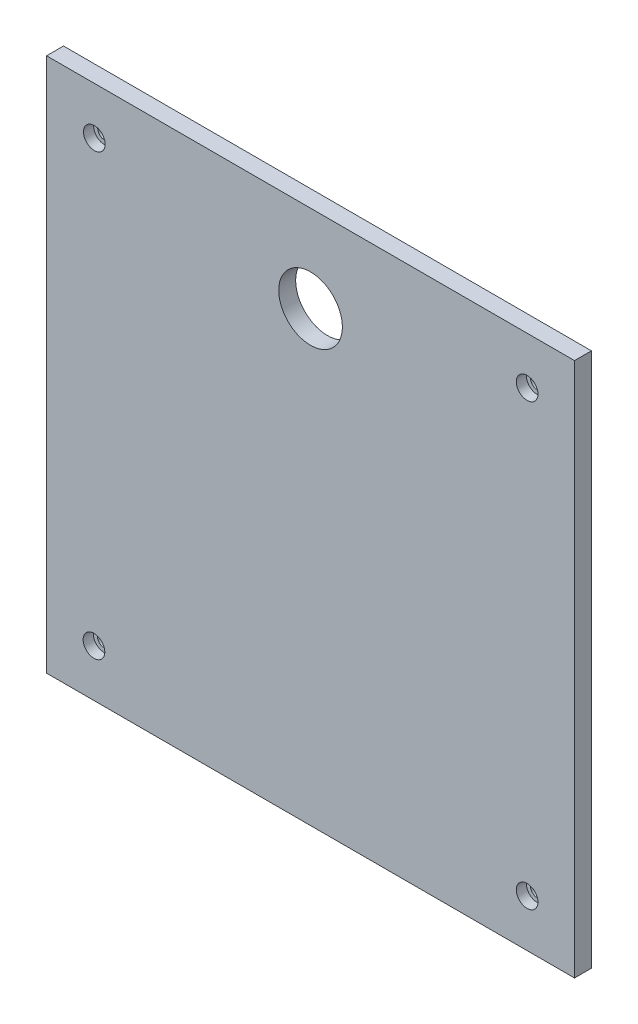
from build123d import *

# Parameters (mm, degrees)
SKETCH_213_W        = 78
SKETCH_213_H        = 79
EXTRUDE_3_DEPTH     = 2.5
CUT_EXTRUDE_4_REACH = 59.522
SKETCH_10_R         = 1.00000254
SKETCH_10_R_2       = 4.7
CUT_EXTRUDE_START   = 1
SKETCH_12_R         = 1.6
CUT_EXTRUDE_6_DEPTH = 2.5
SKETCH_11_W         = 57.00006223
SKETCH_11_H         = 48.946928069
CUT_EXTRUDE_7_DEPTH = 1


with BuildPart() as part:
    # Sketch 213 → 凸台-拉伸3 (new body)
    with BuildSketch(Plane.XY):
        with Locations((1.76392246, -1.007858704)):
            Rectangle(SKETCH_213_W, SKETCH_213_H)
    extrude(amount=EXTRUDE_3_DEPTH)

    # Sketch 10 → 切除-拉伸4 (cut, up to next)
    with BuildSketch(Plane.XY, mode=Mode.PRIVATE) as cut_extrude_4_sk1:
        with Locations((-30.179759278, 31.492141296)):
            Circle(SKETCH_10_R)
    cut_extrude_4_tool1 = extrude(cut_extrude_4_sk1.sketch, amount=CUT_EXTRUDE_4_REACH, mode=Mode.PRIVATE) & part.part
    # Sketch 10 → 切除-拉伸4 (cut, up to next)
    with BuildSketch(Plane.XY, mode=Mode.PRIVATE) as cut_extrude_4_sk2:
        with Locations((33.76398723, 31.492283536)):
            Circle(SKETCH_10_R)
    cut_extrude_4_tool2 = extrude(cut_extrude_4_sk2.sketch, amount=CUT_EXTRUDE_4_REACH, mode=Mode.PRIVATE) & part.part
    # Sketch 10 → 切除-拉伸4 (cut, up to next)
    with BuildSketch(Plane.XY, mode=Mode.PRIVATE) as cut_extrude_4_sk3:
        with Locations((33.76398723, -33.507848544)):
            Circle(SKETCH_10_R)
    cut_extrude_4_tool3 = extrude(cut_extrude_4_sk3.sketch, amount=CUT_EXTRUDE_4_REACH, mode=Mode.PRIVATE) & part.part
    # Sketch 10 → 切除-拉伸4 (cut, up to next)
    with BuildSketch(Plane.XY, mode=Mode.PRIVATE) as cut_extrude_4_sk4:
        with Locations((-30.23614231, -33.507848544)):
            Circle(SKETCH_10_R)
    cut_extrude_4_tool4 = extrude(cut_extrude_4_sk4.sketch, amount=CUT_EXTRUDE_4_REACH, mode=Mode.PRIVATE) & part.part
    # Sketch 10 → 切除-拉伸4 (cut, up to next)
    with BuildSketch(Plane.XY, mode=Mode.PRIVATE) as cut_extrude_4_sk5:
        with Locations((1.764114511, 25.639082065)):
            Circle(SKETCH_10_R_2)
    cut_extrude_4_tool5 = extrude(cut_extrude_4_sk5.sketch, amount=CUT_EXTRUDE_4_REACH, mode=Mode.PRIVATE) & part.part
    add(cut_extrude_4_tool1.solids().sort_by_distance((-30.179759, 31.492141, 0))[0], mode=Mode.SUBTRACT)
    add(cut_extrude_4_tool2.solids().sort_by_distance((33.763987, 31.492284, 0))[0], mode=Mode.SUBTRACT)
    add(cut_extrude_4_tool3.solids().sort_by_distance((33.763987, -33.507849, 0))[0], mode=Mode.SUBTRACT)
    add(cut_extrude_4_tool4.solids().sort_by_distance((-30.236142, -33.507849, 0))[0], mode=Mode.SUBTRACT)
    add(cut_extrude_4_tool5.solids().sort_by_distance((1.764115, 25.639082, 0))[0], mode=Mode.SUBTRACT)

    # 外壳尺寸<12> → 切除-拉伸6 (cut)
    with BuildSketch(Plane.XY.offset(CUT_EXTRUDE_START)):
        with Locations((-30.179759278, 31.492141296)):
            Circle(SKETCH_12_R)
        with Locations((33.76398723, 31.492283536)):
            Circle(SKETCH_12_R)
        with Locations((-30.23614231, -33.507848544)):
            Circle(SKETCH_12_R)
        with Locations((33.76398723, -33.507848544)):
            Circle(SKETCH_12_R)
    extrude(amount=CUT_EXTRUDE_6_DEPTH, mode=Mode.SUBTRACT)

    # 草图11 → 切除-拉伸7 (cut)
    with BuildSketch(Plane(origin=(0, 0, 0), x_dir=(-1, 0, 0), z_dir=(0, 0, -1))):
        with Locations((-1.263953575, -5.03438197)):
            Rectangle(SKETCH_11_W, SKETCH_11_H)
    extrude(amount=-CUT_EXTRUDE_7_DEPTH, mode=Mode.SUBTRACT)


solid = part.part
